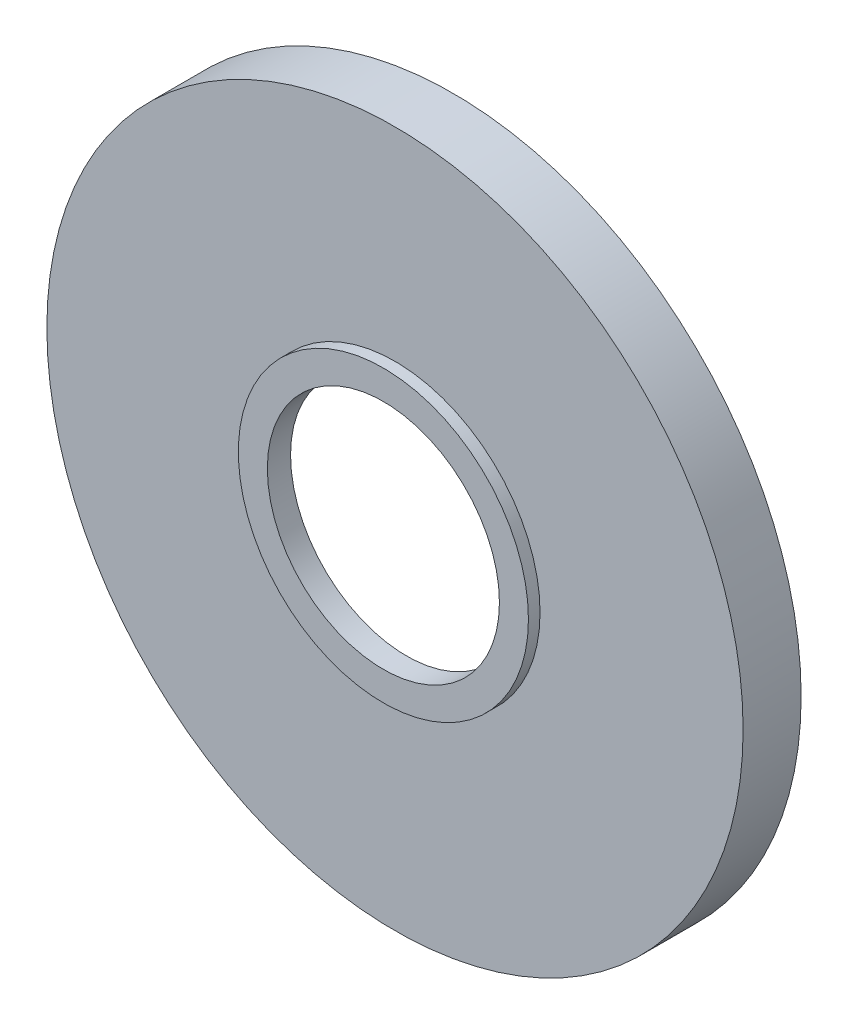
from build123d import *

# Parameters (mm, degrees)
SKETCH_1_R      = 60
SKETCH_1_R_2    = 57
EXTRUDE_1_DEPTH = 8
SKETCH_2_R      = 60
SKETCH_2_R_2    = 20
EXTRUDE_2_DEPTH = 2
SKETCH_3_R      = 25
SKETCH_3_R_2    = 20
EXTRUDE_3_DEPTH = 2


with BuildPart() as part:
    # 草图1 → 拉伸-薄壁1 (new body)
    with BuildSketch(Plane.XY):
        Circle(SKETCH_1_R)
        Circle(SKETCH_1_R_2, mode=Mode.SUBTRACT)
    extrude(amount=EXTRUDE_1_DEPTH)

    # 草图2 → 拉伸-薄壁2 (add)
    with BuildSketch(Plane.XY.offset(8)):
        Circle(SKETCH_2_R)
        Circle(SKETCH_2_R_2, mode=Mode.SUBTRACT)
    extrude(amount=EXTRUDE_2_DEPTH)

    # 草图3 → 拉伸-薄壁3 (add)
    with BuildSketch(Plane.XY.offset(10)):
        Circle(SKETCH_3_R)
        Circle(SKETCH_3_R_2, mode=Mode.SUBTRACT)
    extrude(amount=EXTRUDE_3_DEPTH)


solid = part.part
